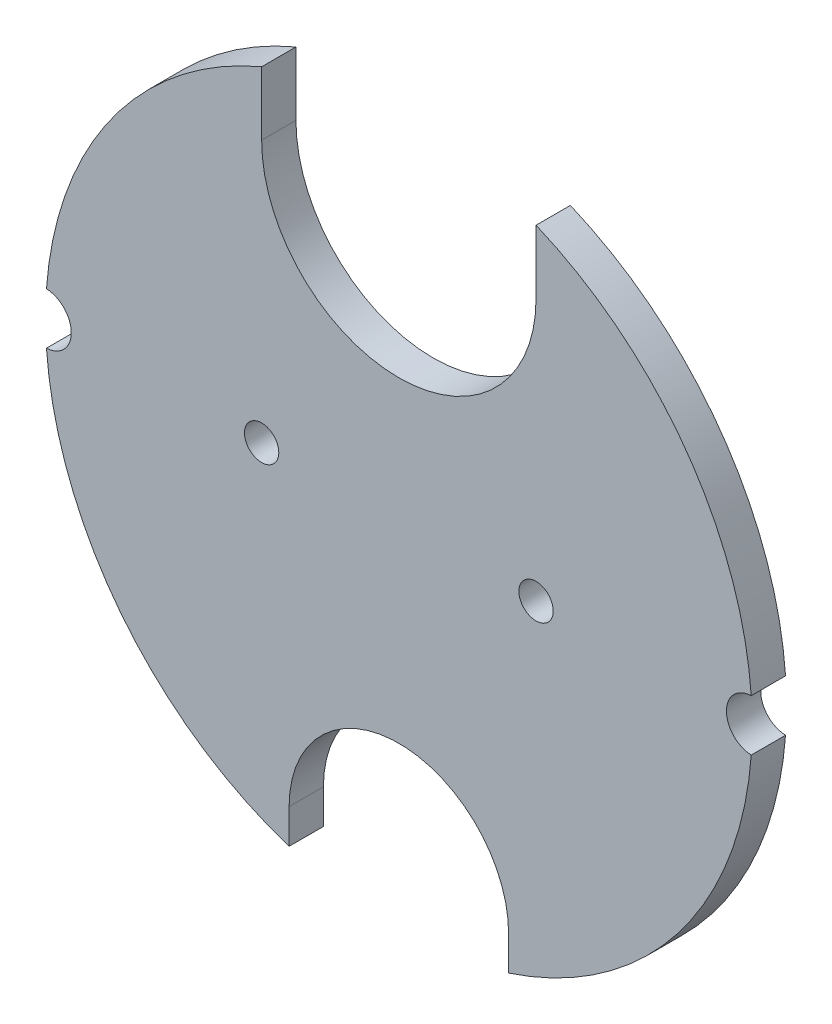
from build123d import *

# Parameters (mm, degrees)
SKETCH1_R      = 65.405
EXTRUDE1_DEPTH = 6.35
SKETCH2_R      = 4.7625
SKETCH2_R_2    = 3.175
EXTRUDE2_DEPTH = 93.714349213


with BuildPart() as part:
    # Sketch1 → Extrude1 (new body)
    with BuildSketch(Plane.XY):
        Circle(SKETCH1_R)
    extrude(amount=EXTRUDE1_DEPTH)

    # Sketch2 → Extrude2 (cut, through all)
    with BuildSketch(Plane.XY.offset(6.35)):
        with Locations((-65.405, 0)):
            Circle(SKETCH2_R)
        with Locations((65.405, 0)):
            Circle(SKETCH2_R)
        with Locations((25.4, 0)):
            Circle(SKETCH2_R_2)
        with Locations((-25.4, 0)):
            Circle(SKETCH2_R_2)
        with BuildLine():
            Line((-25.4, 48.509773864), (-25.4, 60.271502595))
            Line((-25.4, 60.271502595), (-25.4, 90.805))
            Line((-25.4, 90.805), (25.4, 90.805))
            Line((25.4, 90.805), (25.4, 60.271502595))
            Line((25.4, 60.271502595), (25.4, 48.509773864))
            ThreePointArc((25.4, 48.509773864), (0, 23.109773864), (-25.4, 48.509773864))
        make_face()
        with BuildLine():
            Line((20.32, -55.802214755), (20.32, -68.502214755))
            Line((20.32, -68.502214755), (-20.32, -68.502214755))
            Line((-20.32, -68.502214755), (-20.32, -55.802214755))
            ThreePointArc((-20.32, -55.802214755), (0, -35.482214755), (20.32, -55.802214755))
        make_face()
    extrude(amount=-EXTRUDE2_DEPTH, mode=Mode.SUBTRACT)


solid = part.part
